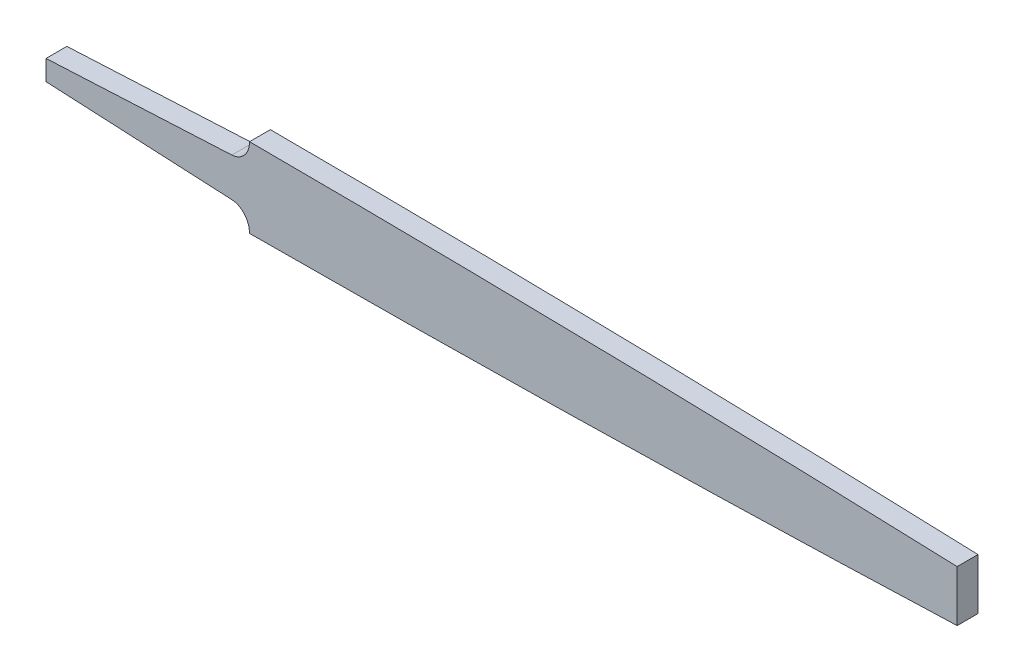
from build123d import *

# Parameters (mm, degrees)
BOSS_EXTRUDE1_DEPTH      = 2.07
BOSS_EXTRUDE1_DEPTH_BACK = 2.07
SCALE1_SCALE_X           = 1.01
SCALE1_SCALE_Y           = 1.1
SCALE1_SCALE_Z           = 1.1


with BuildPart() as part:
    # Sketch1 → Boss-Extrude1 (new, two sides: drawn at the far end of the back side and taken through both)
    with BuildSketch(Plane.XY.offset(-BOSS_EXTRUDE1_DEPTH_BACK)):
        with BuildLine():
            Line((-98.5, -2), (-98.5, 2))
            Line((-98.5, 2), (-58.317523483, 3.835))
            ThreePointArc((-58.317523483, 3.835), (-55.607777146, 5.067676748), (-54.5, 7.830835622))
            Line((-54.5, 7.830835622), (-54.5, 7.885))
            add(Edge.make_bspline(
                [(-54.5, 7.885), (22.028887168, 7.680718763), (98.5, 5.075)],
                knots=[0, 0, 0, 1, 1, 1], degree=2))
            Line((98.5, 5.075), (98.5, -5.075))
            add(Edge.make_bspline(
                [(-54.5, -7.885), (22.028887168, -7.680718763), (98.5, -5.075)],
                knots=[0, 0, 0, 1, 1, 1], degree=2))
            Line((-54.5, -7.885), (-54.5, -7.830835622))
            ThreePointArc((-54.5, -7.830835622), (-55.607777146, -5.067676748), (-58.317523483, -3.835))
            Line((-58.317523483, -3.835), (-98.5, -2))
        make_face()
    extrude(amount=BOSS_EXTRUDE1_DEPTH + BOSS_EXTRUDE1_DEPTH_BACK)


with BuildPart() as part_1:
    # Scale1: scaled about (0, 0, 0)
    add(part.part.scale((SCALE1_SCALE_X, SCALE1_SCALE_Y, SCALE1_SCALE_Z), about=(0, 0, 0)))


solid = part_1.part
